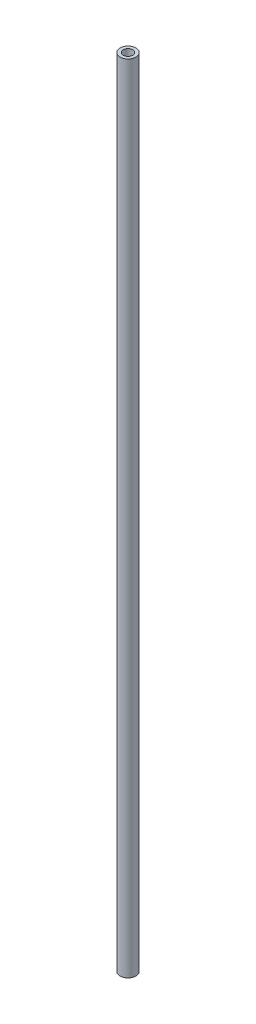
from build123d import *

# Parameters (mm, degrees)
SKETCH_1_R      = 2.5
SKETCH_1_R_2    = 1.5
EXTRUDE_1_DEPTH = 250


with BuildPart() as part:
    # 草图1 → 凸台-拉伸1 (new body)
    with BuildSketch(Plane(origin=(0, 0, 0), x_dir=(1, 0, 0), z_dir=(0, 1, 0))):
        with Locations(Location((0, 0, 0), (0, 0, 270))):
            Circle(SKETCH_1_R)
        with Locations(Location((0, 0, 0), (0, 0, 270))):
            Circle(SKETCH_1_R_2, mode=Mode.SUBTRACT)
    extrude(amount=EXTRUDE_1_DEPTH)


solid = part.part
